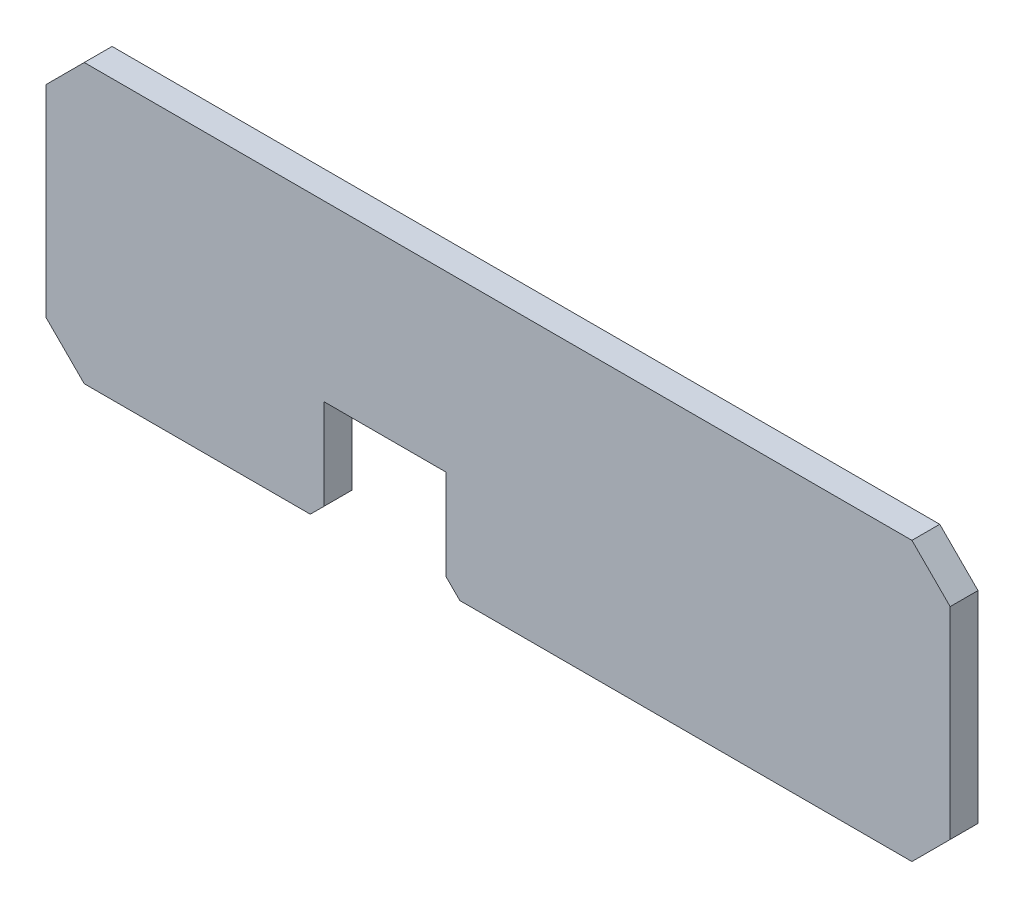
from build123d import *

# Parameters (mm, degrees)
BOSS_EXTRUDE1_DEPTH = 5.08


with BuildPart() as part:
    # Sketch1 → Boss-Extrude1 (new body)
    with BuildSketch(Plane.XY):
        Polygon((-75.565, 25.4), (75.565, 25.4), (82.55, 18.415), (82.55, -18.415), (75.565, -25.4), (-6.985, -25.4), (-9.525, -22.86), (-9.525, -6.35), (-31.75, -6.35), (-31.75, -22.86), (-34.29, -25.4), (-75.565, -25.4), (-82.55, -18.415), (-82.55, 18.415), align=None)
    extrude(amount=BOSS_EXTRUDE1_DEPTH)


solid = part.part
